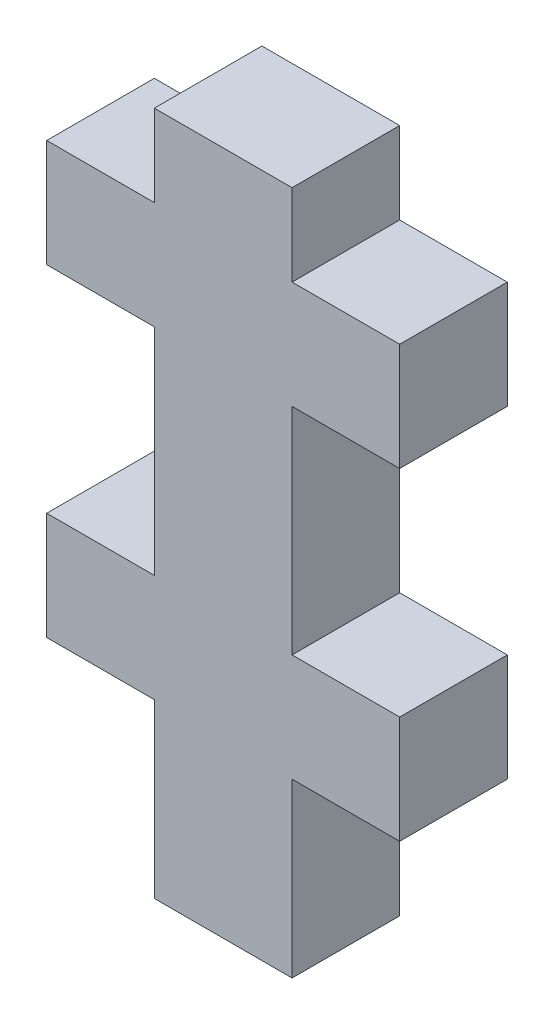
from build123d import *

# Parameters (mm, degrees)
BOSS_EXTRUDE1_DEPTH = 5


with BuildPart() as part:
    # Sketch1 → Boss-Extrude1 (new body)
    with BuildSketch(Plane.XY):
        Polygon((0, 0), (6.4, 0), (6.4, 8), (11.4, 8), (11.4, 13), (6.4, 13), (6.4, 23), (11.4, 23), (11.4, 28), (6.4, 28), (6.4, 31.8), (0, 31.8), (0, 28), (-5, 28), (-5, 23), (0, 23), (0, 13), (-5, 13), (-5, 8), (0, 8), align=None)
    extrude(amount=BOSS_EXTRUDE1_DEPTH)


solid = part.part
